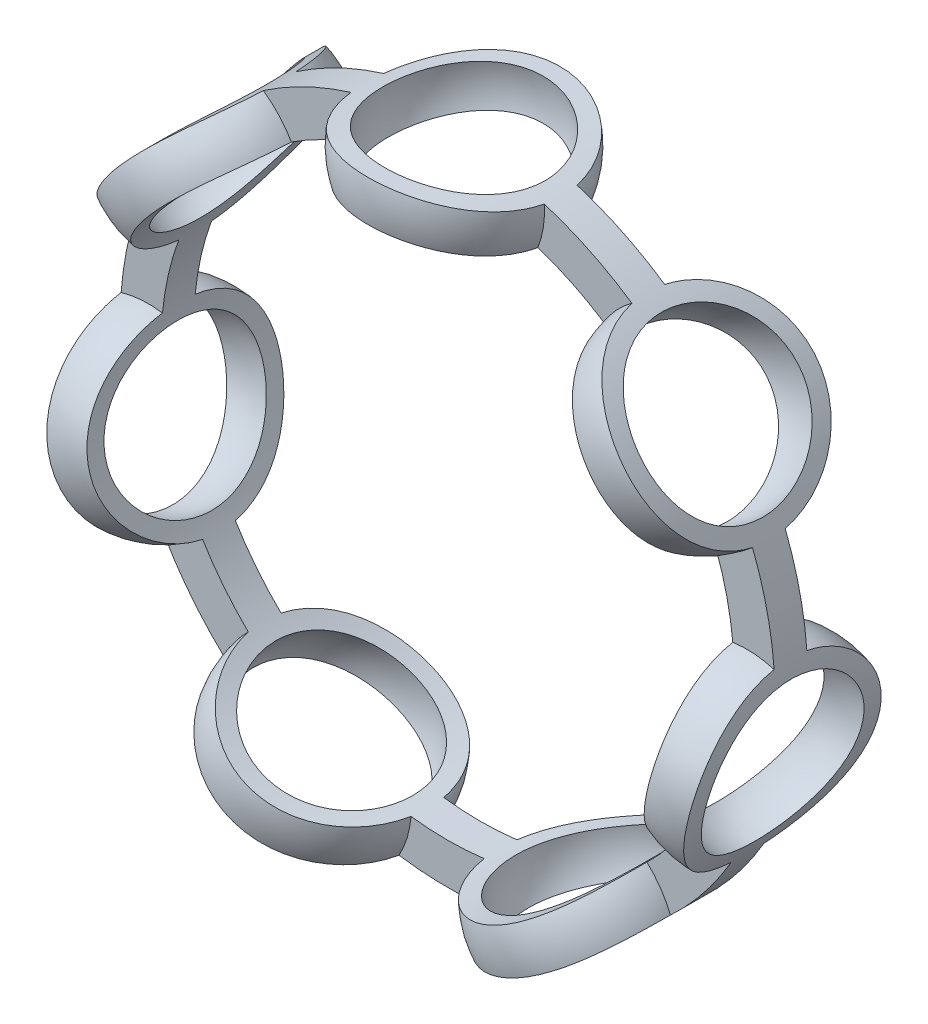
from build123d import *

# Parameters (mm, degrees)
ESQUISSE1_R                  = 8
ESQUISSE1_R_2                = 7
BASE_EXTRU_MINCE_DEPTH       = 0.4
R_P_TITION_CIRCULAIRE1_COUNT = 7
ESQUISSE4_OUTSIDE_W          = 26.95
ESQUISSE4_OUTSIDE_H          = 26.583
ESQUISSE4_OUTSIDE_R          = 8
ESQUISSE4_OUTSIDE_R_2        = 7
ENL_V_MAT_EXTRU_1_DEPTH      = 5


with BuildPart() as part:
    # Esquisse1 → Base-Extru.-Mince (new, symmetric)
    with BuildSketch(Plane.XY):
        Circle(ESQUISSE1_R)
        Circle(ESQUISSE1_R_2, mode=Mode.SUBTRACT)
    extrude(amount=BASE_EXTRU_MINCE_DEPTH, both=True)

    # Esquisse2 → Boss.-Révol.1 (revolve)
    with BuildSketch(Plane.XY):
        with BuildLine():
            Line((0, 9.9), (0, 5.1))
            ThreePointArc((0, 5.1), (-2.4, 7.5), (0, 9.9))
        make_face()
    boss_r_vol_1 = revolve(axis=Axis((0, 1.057268722, 0), (0, 1, 0)))

    # Esquisse3 → Enlèvement de matière-Révolution2 (revolve, cut)
    with BuildSketch(Plane.XY):
        with BuildLine():
            Line((0, 5.5), (0, 9.5))
            ThreePointArc((0, 9.5), (-2, 7.5), (0, 5.5))
        make_face()
    enl_vement_de_mati_re_r_volution2 = revolve(axis=Axis((0, 12.291659193, 0), (0, -1, 0)), mode=Mode.SUBTRACT)

    # Répétition circulaire1: Boss.-Révol.1, Enlèvement de matière-Révolution2 ×7 about axis
    r_p_tition_circulaire1_axis = Axis((0, 0, 0), (0, 0, 1))
    add([boss_r_vol_1.rotate(r_p_tition_circulaire1_axis, i * 360 / R_P_TITION_CIRCULAIRE1_COUNT) for i in range(1, R_P_TITION_CIRCULAIRE1_COUNT)])
    add([enl_vement_de_mati_re_r_volution2.rotate(r_p_tition_circulaire1_axis, i * 360 / R_P_TITION_CIRCULAIRE1_COUNT) for i in range(1, R_P_TITION_CIRCULAIRE1_COUNT)], mode=Mode.SUBTRACT)

    # Esquisse4 outside → Enlèv. mat.-Extru.1 (cut, symmetric)
    # profile 1 of 2: a face of its own
    with BuildSketch(Plane.XY):
        with Locations((0, 0.3715)):
            Rectangle(ESQUISSE4_OUTSIDE_W, ESQUISSE4_OUTSIDE_H)
        with Locations(Location((0, 0, 0), (0, 0, 158.60175355))):
            Circle(ESQUISSE4_OUTSIDE_R, mode=Mode.SUBTRACT)
    # profile 2 of 2: a face of its own
    with BuildSketch(Plane.XY):
        with Locations(Location((0, 0, 0), (0, 0, 159.797396208))):
            Circle(ESQUISSE4_OUTSIDE_R_2)
    extrude(amount=ENL_V_MAT_EXTRU_1_DEPTH, both=True, mode=Mode.SUBTRACT)


solid = part.part
